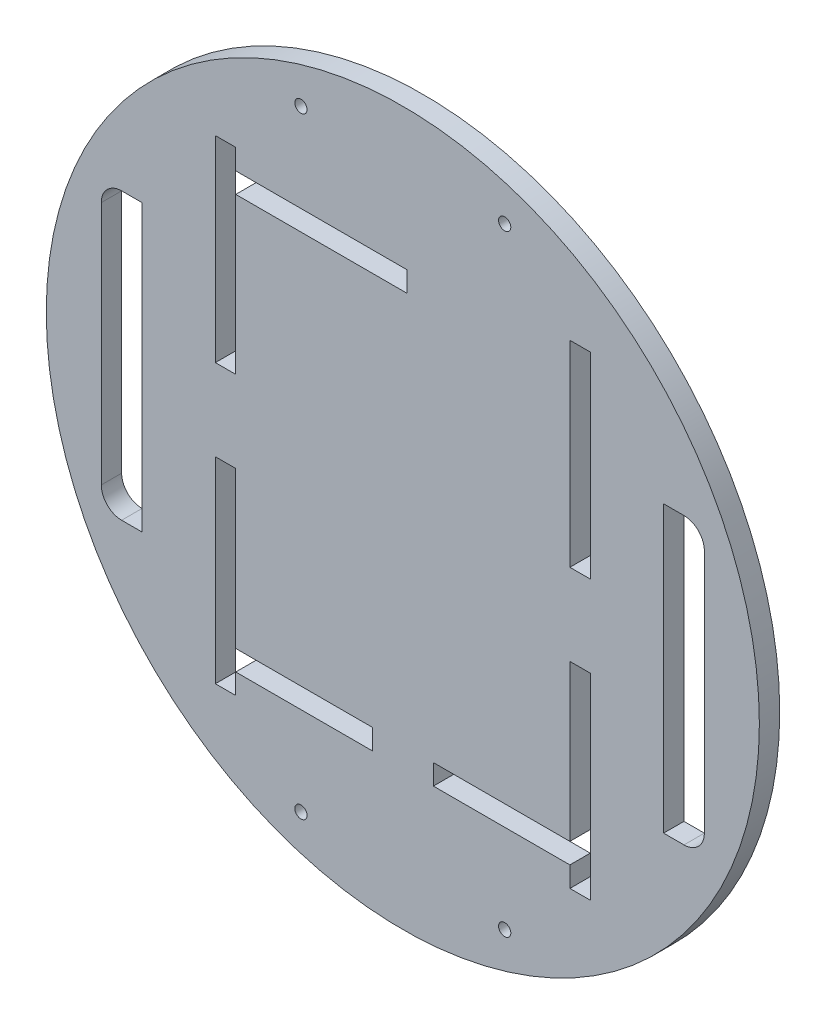
from build123d import *

# Parameters (mm, degrees)
SKETCH_1_R          = 87.5
EXTRUDE_1_DEPTH     = 5
CUT_EXTRUDE_1_DEPTH = 124.844660765
SKETCH_2_R          = 1.5
CUT_EXTRUDE_2_DEPTH = 124.844660765
SKETCH_4_W          = 5
SKETCH_4_H          = 48.25
CUT_EXTRUDE_4_DEPTH = 124.844660765
SKETCH_5_W          = 42
SKETCH_5_H          = 5
SKETCH_5_W_2        = 33.5
CUT_EXTRUDE_7_DEPTH = 124.844660765


with BuildPart() as part:
    # 草圖1 → 填料-伸長1 (new body)
    with BuildSketch(Plane.XY):
        Circle(SKETCH_1_R)
    extrude(amount=EXTRUDE_1_DEPTH)

    # 草圖3 → 除料-伸長1 (cut, through all)
    with BuildSketch(Plane.XY.offset(5)):
        with BuildLine():
            ThreePointArc((-69, -35), (-72.535533906, -33.535533906), (-74, -30))
            Line((-74, -30), (-74, 30))
            ThreePointArc((-74, 30), (-72.535533906, 33.535533906), (-69, 35))
            Line((-69, 35), (-64, 35))
            Line((-64, 35), (-64, -35))
            Line((-64, -35), (-69, -35))
        make_face()
        with BuildLine():
            Line((64, 35), (64, -35))
            Line((64, -35), (69, -35))
            ThreePointArc((69, -35), (72.535533906, -33.535533906), (74, -30))
            Line((74, -30), (74, 30))
            ThreePointArc((74, 30), (72.535533906, 33.535533906), (69, 35))
            Line((69, 35), (64, 35))
        make_face()
    extrude(amount=-CUT_EXTRUDE_1_DEPTH, mode=Mode.SUBTRACT)

    # 草圖2 → 除料-伸長2 (cut, through all)
    with BuildSketch(Plane.XY.offset(5)):
        with Locations((-25, 75)):
            Circle(SKETCH_2_R)
        with Locations(Location((-25, -75, 0), (0, 0, 180))):
            Circle(SKETCH_2_R)
        with Locations(Location((25, 75, 0), (0, 0, 180))):
            Circle(SKETCH_2_R)
        with Locations((25, -75)):
            Circle(SKETCH_2_R)
    extrude(amount=-CUT_EXTRUDE_2_DEPTH, mode=Mode.SUBTRACT)

    # 草圖4 → 除料-伸長4 (cut, through all)
    with BuildSketch(Plane.XY.offset(5)):
        with Locations((43.5, -34.125)):
            Rectangle(SKETCH_4_W, SKETCH_4_H)
        with Locations((43.5, 34.125)):
            Rectangle(SKETCH_4_W, SKETCH_4_H)
        with Locations((-43.5, 34.125)):
            Rectangle(SKETCH_4_W, SKETCH_4_H)
        with Locations((-43.5, -34.125)):
            Rectangle(SKETCH_4_W, SKETCH_4_H)
    extrude(amount=-CUT_EXTRUDE_4_DEPTH, mode=Mode.SUBTRACT)

    # 草圖5 → 除料-伸長7 (cut, through all)
    with BuildSketch(Plane.XY.offset(5)):
        with Locations((-20, 50.75)):
            Rectangle(SKETCH_5_W, SKETCH_5_H)
        with Locations((-24.25, -50.75)):
            Rectangle(SKETCH_5_W_2, SKETCH_5_H)
        with Locations((24.25, -50.75)):
            Rectangle(SKETCH_5_W_2, SKETCH_5_H)
    extrude(amount=-CUT_EXTRUDE_7_DEPTH, mode=Mode.SUBTRACT)


solid = part.part
